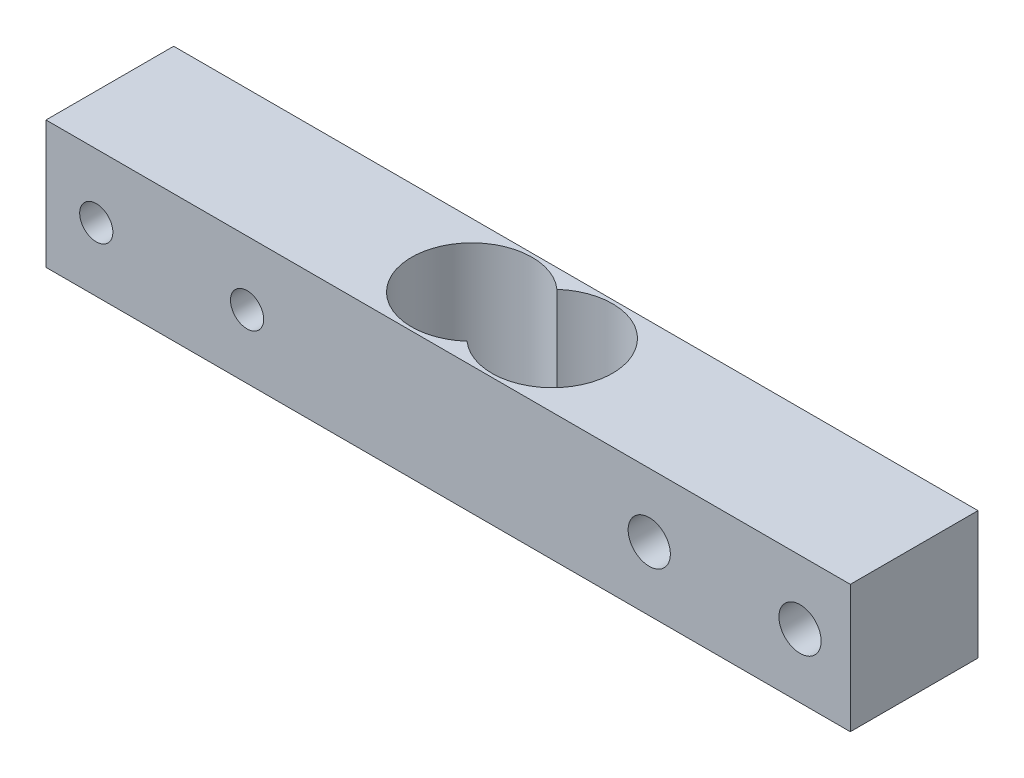
from build123d import *

# Parameters (mm, degrees)
SKETCH1_W               = 80
SKETCH1_H               = 12.7
BOSS_EXTRUDE1_DEPTH     = 12.7
TAP_DRILL_FOR_M5_TAP1_D = 4.2
TAP_DRILL_FOR_M4_TAP1_D = 3.3
SKETCH6_R               = 6
CUT_EXTRUDE1_DEPTH      = 44.847234804


with BuildPart() as part:
    # Sketch1 → Boss-Extrude1 (new body)
    with BuildSketch(Plane.XY):
        Rectangle(SKETCH1_W, SKETCH1_H)
    extrude(amount=-BOSS_EXTRUDE1_DEPTH)

    # Tap Drill for M5 Tap1 (through all)
    with Locations(Plane.XY):
        with Locations((20, 0), (35, 0)):
            Hole(TAP_DRILL_FOR_M5_TAP1_D / 2)

    # Tap Drill for M4 Tap1 (through all)
    with Locations(Plane.XY):
        with Locations((-35, 0), (-20, 0)):
            Hole(TAP_DRILL_FOR_M4_TAP1_D / 2)

    # Sketch6 → Cut-Extrude1 (cut, through all)
    with BuildSketch(Plane(origin=(0, 6.35, 0), x_dir=(1, 0, 0), z_dir=(0, 1, 0))):
        with Locations((-4, 6.35)):
            Circle(SKETCH6_R)
        with Locations((4, 6.35)):
            Circle(SKETCH6_R)
    extrude(amount=-CUT_EXTRUDE1_DEPTH, mode=Mode.SUBTRACT)


solid = part.part
